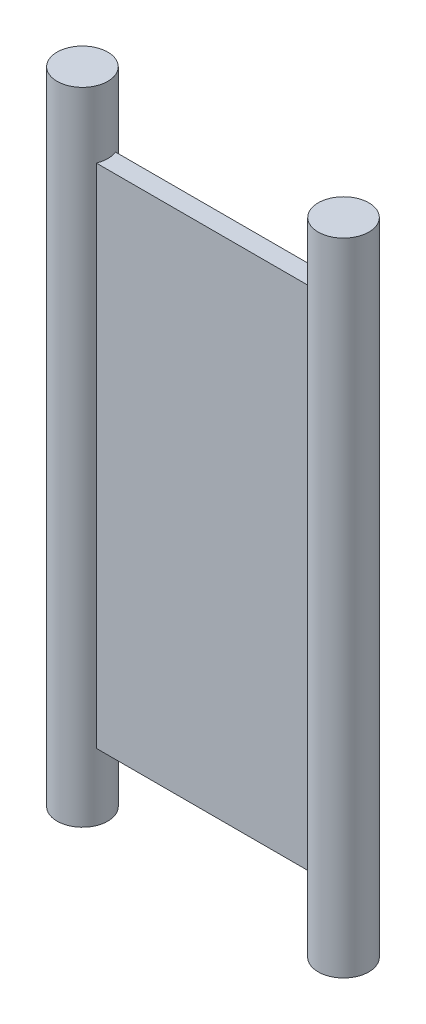
from build123d import *

# Parameters (mm, degrees)
SKETCH1_W           = 13.65
SKETCH1_H           = 1
BOSS_EXTRUDE1_DEPTH = 26.5
SKETCH2_R           = 1.325
BOSS_EXTRUDE2_DEPTH = 16.75


with BuildPart() as part:
    # Sketch1 → Boss-Extrude1 (new body)
    with BuildSketch(Plane(origin=(0, 0, 0), x_dir=(1, 0, 0), z_dir=(0, 1, 0))):
        Rectangle(SKETCH1_W, SKETCH1_H)
    extrude(amount=BOSS_EXTRUDE1_DEPTH)

    # Sketch2 → Boss-Extrude2 (add, symmetric)
    with BuildSketch(Plane(origin=(0, 13.25, 0), x_dir=(1, 0, 0), z_dir=(0, 1, 0))):
        with Locations(Location((-6.825, 0, 0), (0, 0, 270))):
            Circle(SKETCH2_R)
        with Locations(Location((6.825, 0, 0), (0, 0, 270))):
            Circle(SKETCH2_R)
    extrude(amount=BOSS_EXTRUDE2_DEPTH, both=True)


solid = part.part
